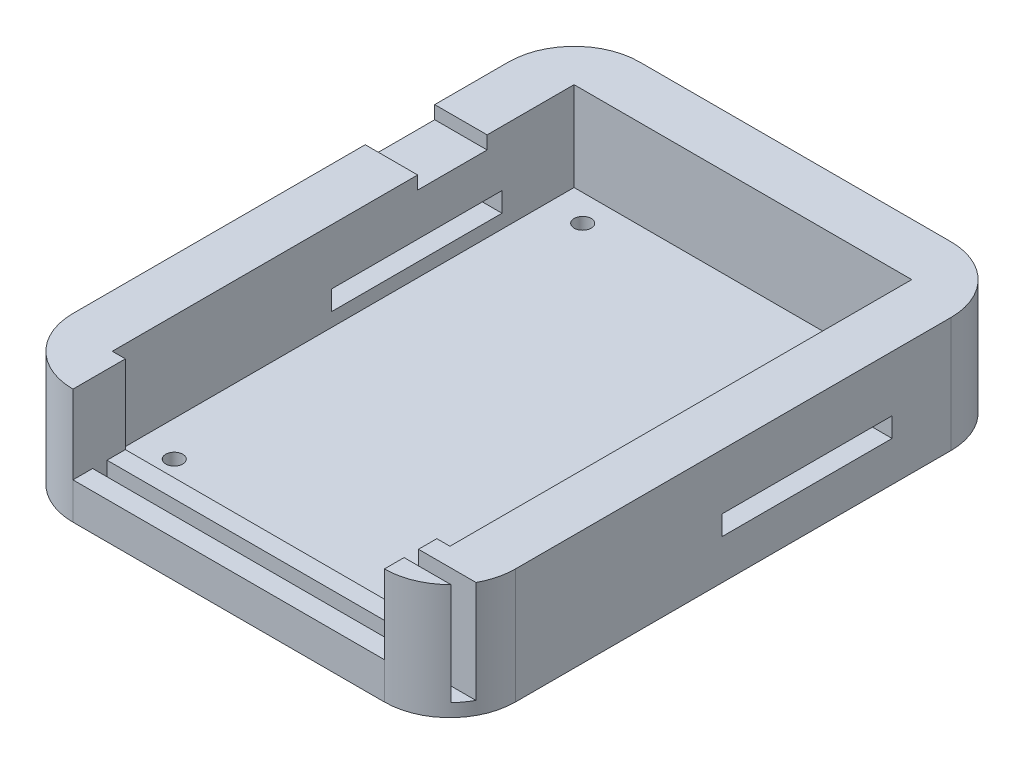
from build123d import *

# Parameters (mm, degrees)
SKETCH_1_W          = 51.55
SKETCH_1_H          = 70.5
SKETCH_1_R          = 1.3
EXTRUDE_1_DEPTH     = 4
SKETCH_2_W          = 51.55
SKETCH_2_H          = 70.5
EXTRUDE_2_DEPTH     = 17.6
SKETCH_4_W          = 47.55
SKETCH_4_H          = 8
CUT_EXTRUDE_1_DEPTH = 12
SKETCH_6_W          = 57.55
SKETCH_6_H          = 15.6
CUT_EXTRUDE_3_DEPTH = 2.2
SKETCH_7_W          = 8
SKETCH_7_H          = 10.60647
CUT_EXTRUDE_4_DEPTH = 2
SKETCH_8_W          = 26
SKETCH_8_H          = 3
CUT_EXTRUDE_5_DEPTH = 83


with BuildPart() as part:
    # 草图1 → 凸台-拉伸1 (new body)
    with BuildSketch(Plane(origin=(0, 0, 0), x_dir=(1, 0, 0), z_dir=(0, 1, 0))):
        Rectangle(SKETCH_1_W, SKETCH_1_H)
        with Locations(Location((-20.3835, 31.1785, 0), (0, 0, 270))):
            Circle(SKETCH_1_R, mode=Mode.SUBTRACT)
        with Locations(Location((20.3835, 31.1785, 0), (0, 0, 90))):
            Circle(SKETCH_1_R, mode=Mode.SUBTRACT)
        with Locations(Location((20.3835, -31.1785, 0), (0, 0, 270))):
            Circle(SKETCH_1_R, mode=Mode.SUBTRACT)
        with Locations(Location((-20.3835, -31.1785, 0), (0, 0, 90))):
            Circle(SKETCH_1_R, mode=Mode.SUBTRACT)
    extrude(amount=EXTRUDE_1_DEPTH)

    # 草图2 → 凸台-拉伸2 (add)
    with BuildSketch(Plane.XZ):
        with BuildLine():
            Line((-23.775, 43.25), (23.775, 43.25))
            ThreePointArc((23.775, 43.25), (30.846067812, 40.321067812), (33.775, 33.25))
            Line((33.775, 33.25), (33.775, -33.25))
            ThreePointArc((33.775, -33.25), (30.846067812, -40.321067812), (23.775, -43.25))
            Line((23.775, -43.25), (-23.775, -43.25))
            ThreePointArc((-23.775, -43.25), (-30.846067812, -40.321067812), (-33.775, -33.25))
            Line((-33.775, -33.25), (-33.775, 33.25))
            ThreePointArc((-33.775, 33.25), (-30.846067812, 40.321067812), (-23.775, 43.25))
        make_face()
        Rectangle(SKETCH_2_W, SKETCH_2_H, mode=Mode.SUBTRACT)
    extrude(amount=-EXTRUDE_2_DEPTH)

    # 草图4 → 切除-拉伸1 (cut)
    with BuildSketch(Plane(origin=(0, 17.6, 0), x_dir=(1, 0, 0), z_dir=(0, 1, 0))):
        with Locations((0, -39.25)):
            Rectangle(SKETCH_4_W, SKETCH_4_H)
    extrude(amount=-CUT_EXTRUDE_1_DEPTH, mode=Mode.SUBTRACT)

    # 草图6 → 切除-拉伸3 (cut)
    with BuildSketch(Plane(origin=(0, 0, 38.05), x_dir=(-1, 0, 0), z_dir=(0, 0, -1))):
        with Locations((-5, 9.8)):
            Rectangle(SKETCH_6_W, SKETCH_6_H)
    extrude(amount=-CUT_EXTRUDE_3_DEPTH, mode=Mode.SUBTRACT)

    # 草图7 → 切除-拉伸4 (cut)
    with BuildSketch(Plane(origin=(0, 17.6, 0), x_dir=(1, 0, 0), z_dir=(0, 1, 0))):
        with Locations((-29.775, 16.673805)):
            Rectangle(SKETCH_7_W, SKETCH_7_H)
    extrude(amount=-CUT_EXTRUDE_4_DEPTH, mode=Mode.SUBTRACT)

    # 草图8 → 切除-拉伸5 (cut)
    with BuildSketch(Plane.ZY.offset(33.775)):
        with Locations((-11.25, 7.6)):
            Rectangle(SKETCH_8_W, SKETCH_8_H)
    extrude(amount=-CUT_EXTRUDE_5_DEPTH, mode=Mode.SUBTRACT)


solid = part.part
